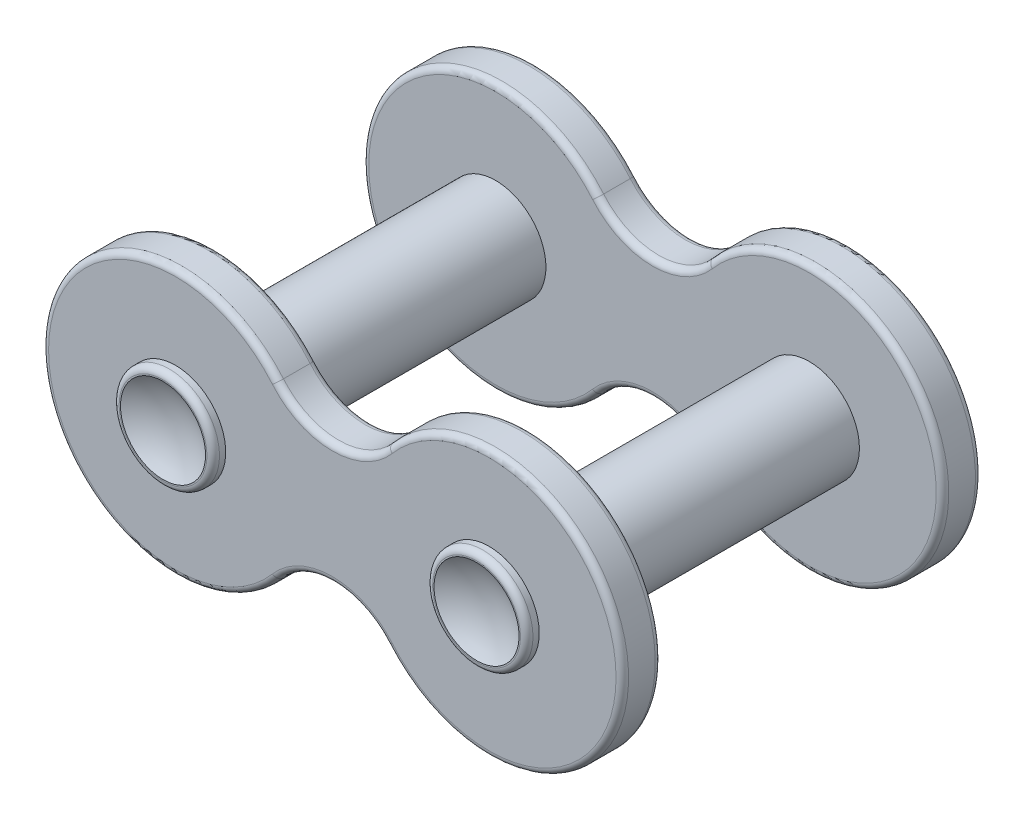
from build123d import *

# Parameters (mm, degrees)
SKETCH1_R           = 1.333335
BOSS_EXTRUDE1_DEPTH = 1.04166667
BOSS_EXTRUDE2_START = 0.33333333
SKETCH2_R           = 1.333335
BOSS_EXTRUDE2_DEPTH = 10.21866666
FILLET1_R           = 0.166666667
FILLET2_R           = 0.166666667


with BuildPart() as part:
    # Sketch1 → Boss-Extrude1 (new body)
    with BuildSketch(Plane.XY):
        with BuildLine():
            ThreePointArc((1.464607213, -2.289601385), (7.7083335, 0), (1.464607213, 2.289601385))
            ThreePointArc((1.464607213, 2.289601385), (0, 1.610940015), (-1.464607213, 2.289601385))
            ThreePointArc((-1.464607213, 2.289601385), (-7.7083335, 0), (-1.464607213, -2.289601385))
            ThreePointArc((-1.464607213, -2.289601385), (0, -1.610940015), (1.464607213, -2.289601385))
        make_face()
        with Locations((4.166667, 0)):
            Circle(SKETCH1_R, mode=Mode.SUBTRACT)
        with Locations(Location((-4.166667, 0, 0), (0, 0, 180))):
            Circle(SKETCH1_R, mode=Mode.SUBTRACT)
    boss_extrude1 = extrude(amount=BOSS_EXTRUDE1_DEPTH)

    # Sketch2 → Boss-Extrude2 (add)
    with BuildSketch(Plane(origin=(0, 0, 0), x_dir=(-1, 0, 0), z_dir=(0, 0, -1)).offset(BOSS_EXTRUDE2_START)):
        with Locations(Location((4.166667, 0, 0), (0, 0, 180))):
            Circle(SKETCH2_R)
    boss_extrude2 = extrude(amount=-BOSS_EXTRUDE2_DEPTH)

    # Mirror1: Boss-Extrude1 across plane
    add(boss_extrude1.mirror(Plane(origin=(0, 0, 4.776), x_dir=(1, 0, 0), z_dir=(0, 0, -1))))

    # Sketch3 → Cut-Revolve1 (revolve, cut)
    with BuildSketch(Plane(origin=(0, 0, 0), x_dir=(1, 0, 0), z_dir=(0, 1, 0))):
        with BuildLine():
            Line((-4.166667, -9.552), (-4.166667, -10.5936665))
            Line((-4.166667, -10.5936665), (-5.970886303, -10.5936665))
            ThreePointArc((-5.970886303, -10.5936665), (-5.2083335, -9.831113697), (-4.166667, -9.552))
        make_face()
    cut_revolve1 = revolve(axis=Axis((-4.166667, 0, 9.552), (0, 0, 1)), mode=Mode.SUBTRACT)

    # Mirror2: Boss-Extrude2, Cut-Revolve1 across plane
    add(boss_extrude2.mirror(Plane(origin=(0, 0, 0), x_dir=(0, 0, 1), z_dir=(1, 0, 0))))
    add(cut_revolve1.mirror(Plane(origin=(0, 0, 0), x_dir=(0, 0, 1), z_dir=(1, 0, 0))), mode=Mode.SUBTRACT)

    # Mirror3: Cut-Revolve1 across plane
    add(cut_revolve1.mirror(Plane(origin=(0, 0, 4.776), x_dir=(1, 0, 0), z_dir=(0, 0, -1))), mode=Mode.SUBTRACT)

    # Mirror4 copy 1 sketch → Mirror4 copy 1 (revolve, cut)
    with BuildSketch(Plane(origin=(0, 0, 9.552), x_dir=(-1, 0, 0), z_dir=(0, 1, 0))):
        with BuildLine():
            Line((-4.166667, -9.552), (-4.166667, -10.5936665))
            Line((-4.166667, -10.5936665), (-5.970886303, -10.5936665))
            ThreePointArc((-5.970886303, -10.5936665), (-5.2083335, -9.831113697), (-4.166667, -9.552))
        make_face()
    revolve(axis=Axis((4.166667, 0, 0), (0, 0, -1)), mode=Mode.SUBTRACT)

    # Mirror4 copy 2 sketch → Mirror4 copy 2 (revolve, cut)
    with BuildSketch(Plane(origin=(0, 0, 0), x_dir=(-1, 0, 0), z_dir=(0, 1, 0))):
        with BuildLine():
            Line((-4.166667, 9.552), (-4.166667, 10.5936665))
            Line((-4.166667, 10.5936665), (-5.970886303, 10.5936665))
            ThreePointArc((-5.970886303, 10.5936665), (-5.2083335, 9.831113697), (-4.166667, 9.552))
        make_face()
    revolve(axis=Axis((4.166667, 0, 9.552), (0, 0, -1)), mode=Mode.SUBTRACT)

    # Fillet1
    fillet1_edges = [part.edges().sort_by_distance(p)[0] for p in [
        (-5.500002, 0, 9.88533333),
        (-5.500002, 0, -0.33333333),
        (5.500002, 0, -0.33333333),
        (5.500002, 0, 9.88533333),
    ]]
    fillet(fillet1_edges, radius=FILLET1_R)

    # Fillet2
    fillet2_edges = [part.edges().sort_by_distance(p)[0] for p in [
        (0, -1.610940015, 1.04166667),
        (7.7083335, 0, 1.04166667),
        (0, 1.610940015, 8.51033333),
        (7.7083335, 0, 8.51033333),
        (0, -1.610940015, 8.51033333),
        (-7.7083335, 0, 8.51033333),
        (0, 1.610940015, 9.552),
        (-7.7083335, 0, 9.552),
        (0, -1.610940015, 9.552),
        (7.7083335, 0, 9.552),
        (0, 1.610940015, 1.04166667),
        (7.7083335, 0, 0),
        (0, -1.610940015, 0),
        (-7.7083335, 0, 0),
        (0, 1.610940015, 0),
        (-7.7083335, 0, 1.04166667),
    ]]
    fillet(fillet2_edges, radius=FILLET2_R)


solid = part.part
